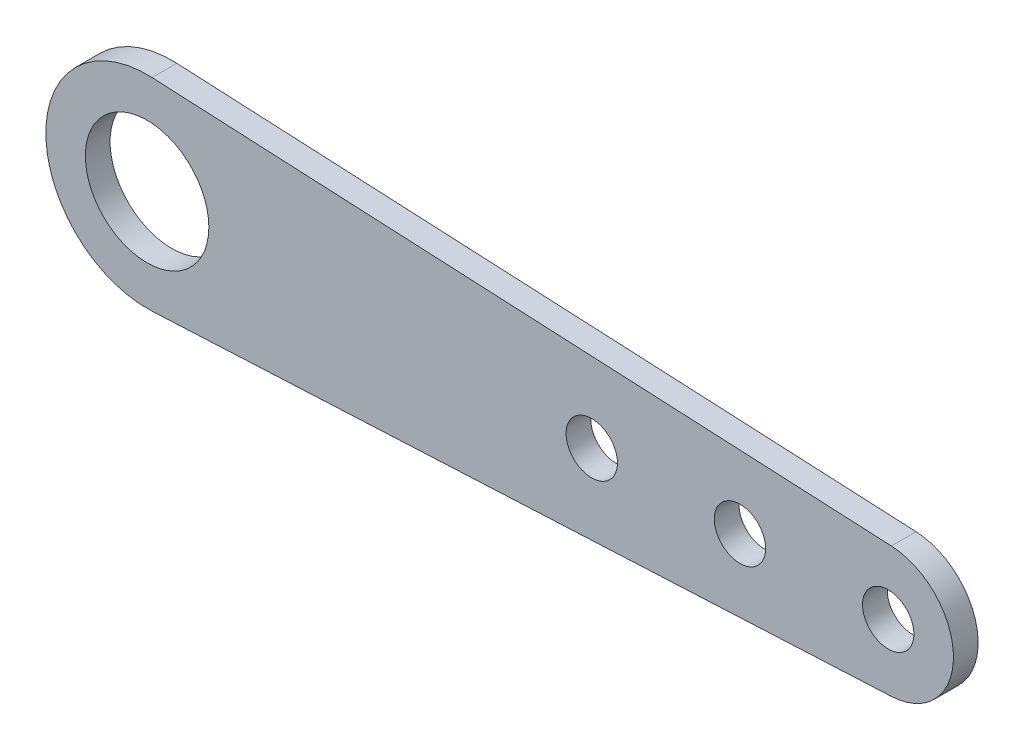
from build123d import *

# Parameters (mm, degrees)
SKETCH1_R           = 7.9375
SKETCH1_R_2         = 3.302
BOSS_EXTRUDE1_DEPTH = 3.175


with BuildPart() as part:
    # Sketch1 → Boss-Extrude1 (new body)
    with BuildSketch(Plane.XY):
        with BuildLine():
            Line((0.633518333, 13.002075249), (95.657924, 8.372067965))
            ThreePointArc((95.657924, 8.372067965), (103.632, 0), (95.657924, -8.372067965))
            Line((95.657924, -8.372067965), (0.633518333, -13.002075249))
            ThreePointArc((0.633518333, -13.002075249), (-13.0175, 0), (0.633518333, 13.002075249))
        make_face()
        Circle(SKETCH1_R, mode=Mode.SUBTRACT)
        with Locations((57.15, 0)):
            Circle(SKETCH1_R_2, mode=Mode.SUBTRACT)
        with Locations((76.2, 0)):
            Circle(SKETCH1_R_2, mode=Mode.SUBTRACT)
        with Locations((95.25, 0)):
            Circle(SKETCH1_R_2, mode=Mode.SUBTRACT)
    extrude(amount=BOSS_EXTRUDE1_DEPTH)


solid = part.part
